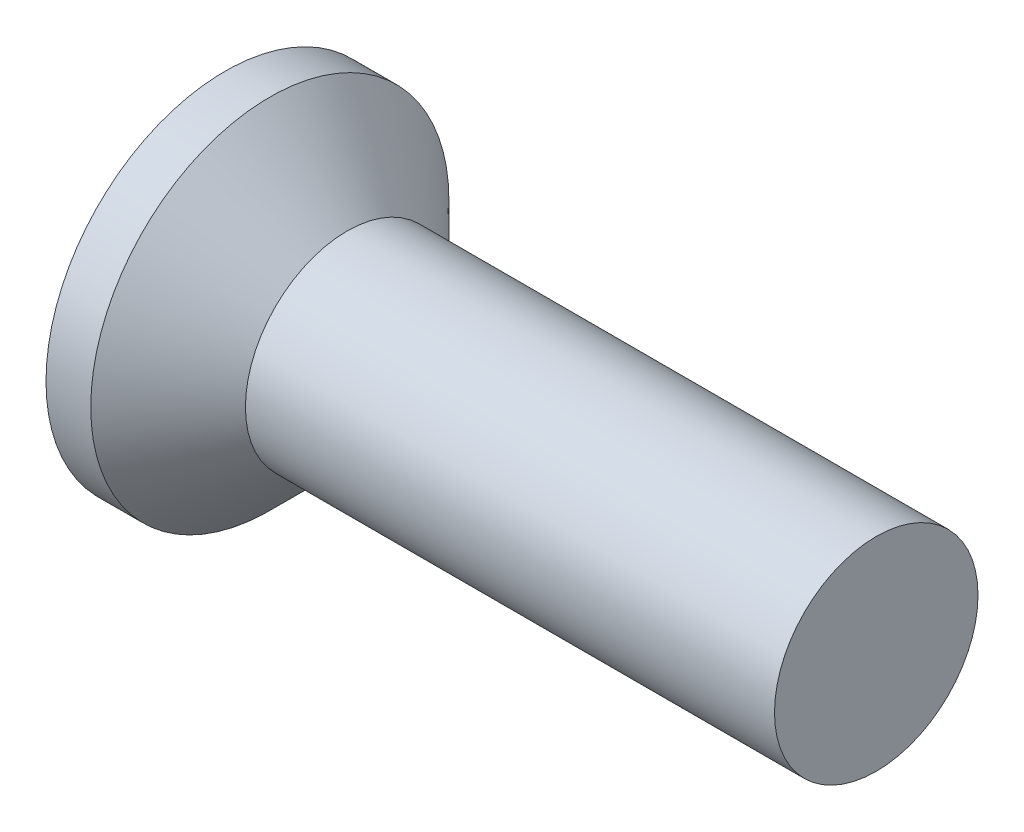
from build123d import *

# Parameters (mm, degrees)
CROSSRECESS_DEPTH = 0.75
DRAFT9_ANGLE      = 30
FILLET5_R         = 0.3


with BuildPart() as part:
    # Sketch1 → Base (revolve)
    with BuildSketch(Plane.XY, mode=Mode.PRIVATE) as base_sk:
        Polygon((8, 1.25), (2.4, 1.25), (1.5, 1.25), (0.55, 2.2), (0, 2.2), (0, 0), (8, 0), align=None)
    revolve(base_sk.sketch.rotate(Axis((4.515812911, 0, 0), (-1, 0, 0)), 90), axis=Axis((4.515812911, 0, 0), (-1, 0, 0)))

    # Sketch6 → CrossRecess (cut)
    with BuildSketch(Plane(origin=(0, 0, 0), x_dir=(0, 0, -1), z_dir=(1, 0, 0))):
        Polygon((0.29, 0.29), (0.29, 1.45), (-0.29, 1.45), (-0.29, 0.29), (-1.45, 0.29), (-1.45, -0.29), (-0.29, -0.29), (-0.29, -1.45), (0.29, -1.45), (0.29, -0.29), (1.45, -0.29), (1.45, 0.29), align=None)
    extrude(amount=CROSSRECESS_DEPTH, mode=Mode.SUBTRACT)

    # Draft9
    draft9_faces = [part.faces().sort_by_distance(p)[0] for p in [
        (0.375, 1.45, 0),
        (0.375, 0, 1.45),
        (0.375, -1.45, 0),
        (0.375, 0, -1.45),
    ]]
    draft(draft9_faces, Plane(origin=(0, 2.2, 0), x_dir=(0, 0, -1), z_dir=(-1, 0, 0)), DRAFT9_ANGLE)

    # Fillet5
    fillet5_edges = [part.edges().sort_by_distance(p)[0] for p in [
        (0.375, 0.29, 0.29),
        (0.375, -0.29, 0.29),
        (0.375, -0.29, -0.29),
        (0.375, 0.29, -0.29),
    ]]
    fillet(fillet5_edges, radius=FILLET5_R)


solid = part.part
